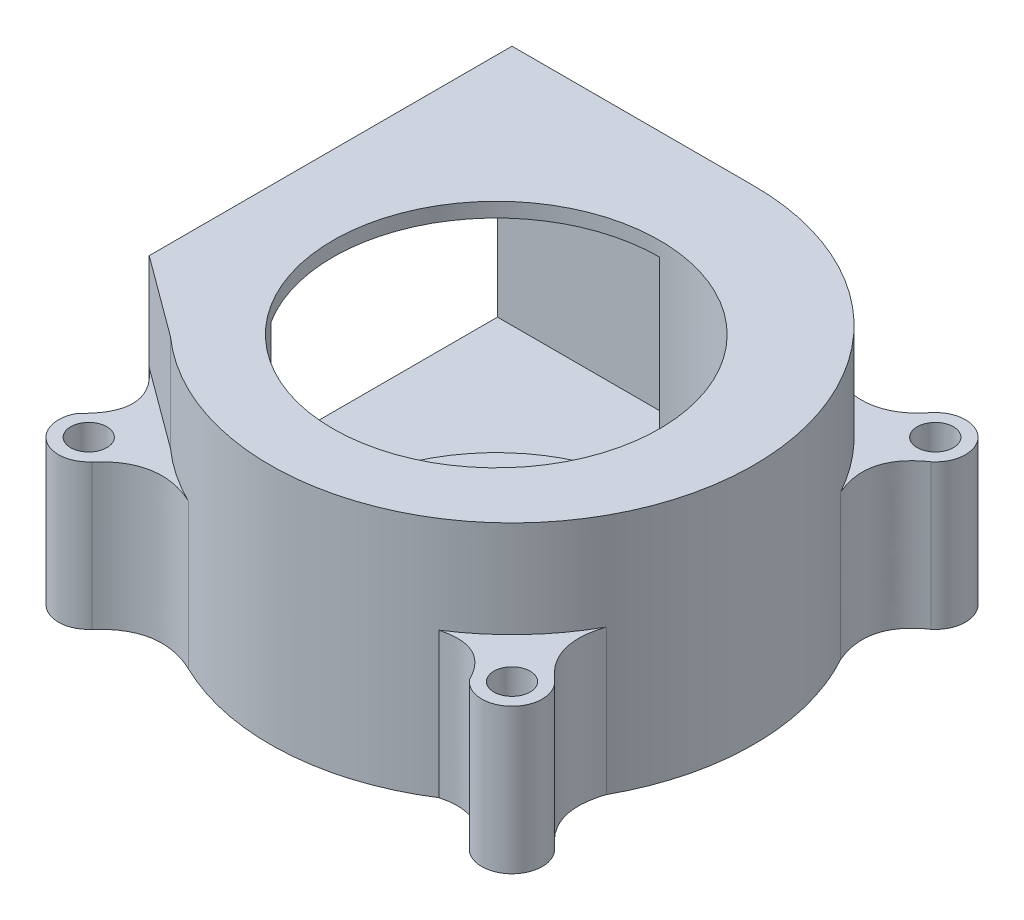
from build123d import *

# Parameters (mm, degrees)
SKETCH_1_W          = 40
SKETCH_1_H          = 40
SKETCH_1_R          = 1.5
EXTRUDE_1_DEPTH     = 20
SKETCH_2_W          = 27.3
SKETCH_2_H          = 17.6
CUT_EXTRUDE_1_DEPTH = 20
SKETCH_3_R          = 13.5
CUT_EXTRUDE_2_DEPTH = 18
SKETCH_4_OUTSIDE_W  = 54
SKETCH_4_OUTSIDE_H  = 54
CUT_EXTRUDE_3_DEPTH = 8
SKETCH_5_OUTSIDE_W  = 54
SKETCH_5_OUTSIDE_H  = 54
CUT_EXTRUDE_4_DEPTH = 58.827329179
SKETCH_6_R          = 13.5
EXTRUDE_2_DEPTH     = 2


with BuildPart() as part:
    # 草图1 → 凸台-拉伸1 (new body)
    with BuildSketch(Plane(origin=(0, 0, 0), x_dir=(1, 0, 0), z_dir=(0, 1, 0))):
        with Locations((20, 20)):
            Rectangle(SKETCH_1_W, SKETCH_1_H)
        with Locations(Location((2.5, 2.5, 0), (0, 0, 270))):
            Circle(SKETCH_1_R, mode=Mode.SUBTRACT)
        with Locations(Location((37.5, 2.5, 0), (0, 0, 270))):
            Circle(SKETCH_1_R, mode=Mode.SUBTRACT)
        with Locations(Location((37.5, 37.5, 0), (0, 0, 270))):
            Circle(SKETCH_1_R, mode=Mode.SUBTRACT)
    extrude(amount=EXTRUDE_1_DEPTH)

    # 草图2 → 切除-拉伸1 (cut)
    with BuildSketch(Plane.ZY):
        with Locations((-25.15, 10)):
            Rectangle(SKETCH_2_W, SKETCH_2_H)
    extrude(amount=-CUT_EXTRUDE_1_DEPTH, mode=Mode.SUBTRACT)

    # 草图3 → 切除-拉伸2 (cut)
    with BuildSketch(Plane(origin=(0, 20, 0), x_dir=(1, 0, 0), z_dir=(0, 1, 0))):
        with Locations(Location((20, 18.7, 0), (0, 0, 270))):
            Circle(SKETCH_3_R)
    extrude(amount=-CUT_EXTRUDE_2_DEPTH, mode=Mode.SUBTRACT)

    # 草图4 outside → 切除-拉伸3 (cut)
    with BuildSketch(Plane(origin=(0, 20, 0), x_dir=(1, 0, 0), z_dir=(0, 1, 0))):
        with Locations((20, 20)):
            Rectangle(SKETCH_4_OUTSIDE_W, SKETCH_4_OUTSIDE_H)
        with BuildLine():
            Line((20, 40), (0, 40))
            Line((0, 40), (0, 20))
            Line((0, 20), (0, 10))
            Line((0, 10), (6.692582543, 5.069740772))
            ThreePointArc((6.692582543, 5.069740772), (38.689638634, 12.879788787), (20, 40))
        make_face(mode=Mode.SUBTRACT)
    extrude(amount=-CUT_EXTRUDE_3_DEPTH, mode=Mode.SUBTRACT)

    # 草图5 outside → 切除-拉伸4 (cut, through all)
    with BuildSketch(Plane(origin=(0, 12, 0), x_dir=(1, 0, 0), z_dir=(0, 1, 0))):
        with Locations((20, 20)):
            Rectangle(SKETCH_5_OUTSIDE_W, SKETCH_5_OUTSIDE_H)
        with BuildLine():
            Line((0, 40), (0, 10))
            add(Edge.make_bspline(
                [(0, 10), (3.638806933, 6.878431862), (0.339826236, 3.758431289)],
                knots=[0, 0, 0, 1, 1, 1], degree=2))
            ThreePointArc((0.339826236, 3.758431289), (1.052952689, 0.461359748), (4.40068463, 0.875993246))
            add(Edge.make_bspline(
                [(11.200276687, 2.039908975), (7.143896711, 3.952452975), (4.40068463, 0.875993246)],
                knots=[0, 0, 0, 1, 1, 1], degree=2))
            ThreePointArc((11.200276687, 2.039908975), (21.144719324, 0.032786432), (30.794624305, 3.163251914))
            add(Edge.make_bspline(
                [(30.794624305, 3.163251914), (34.063948175, 4.035889324), (35.59931537, 0.875993246)],
                knots=[0, 0, 0, 1, 1, 1], degree=2))
            ThreePointArc((35.59931537, 0.875993246), (39.241156707, 0.706017469), (39.180073086, 4.351311542))
            add(Edge.make_bspline(
                [(37.5, 10.317541634), (36.319762019, 6.765651399), (39.180073086, 4.351311542)],
                knots=[0, 0, 0, 1, 1, 1], degree=2))
            ThreePointArc((37.5, 10.317541634), (40, 20), (37.5, 29.682458366))
            add(Edge.make_bspline(
                [(37.5, 29.682458366), (35.925102207, 33.39107959), (39.07643597, 35.559677957)],
                knots=[0, 0, 0, 1, 1, 1], degree=2))
            ThreePointArc((39.07643597, 35.559677957), (39.289523468, 39.245739315), (35.59931537, 39.124006754))
            add(Edge.make_bspline(
                [(29.682458366, 37.5), (33.334347744, 36.215512873), (35.59931537, 39.124006754)],
                knots=[0, 0, 0, 1, 1, 1], degree=2))
            ThreePointArc((29.682458366, 37.5), (25, 39.364916731), (20, 40))
            Line((20, 40), (0, 40))
        make_face(mode=Mode.SUBTRACT)
    extrude(amount=-CUT_EXTRUDE_4_DEPTH, mode=Mode.SUBTRACT)

    # 草图6 → 凸台-拉伸2 (add)
    with BuildSketch(Plane(origin=(0, 2, 0), x_dir=(1, 0, 0), z_dir=(0, 1, 0))):
        with Locations(Location((20, 18.7, 0), (0, 0, 270))):
            Circle(SKETCH_6_R)
    extrude(amount=-EXTRUDE_2_DEPTH)


solid = part.part
